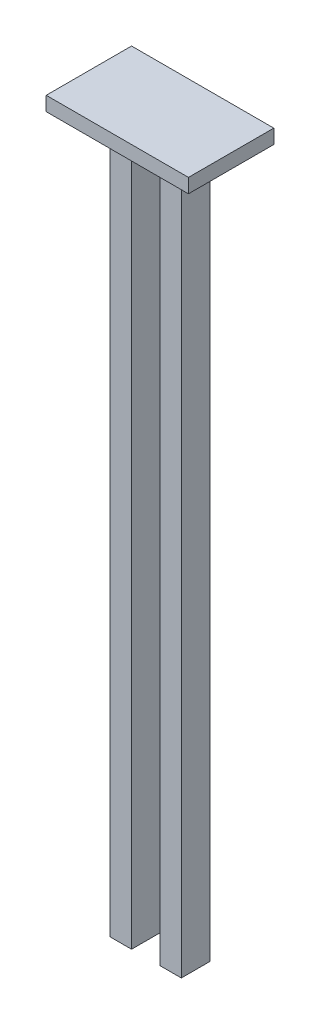
from build123d import *

# Parameters (mm, degrees)
SKETCH1_W           = 10
SKETCH1_H           = 6
BOSS_EXTRUDE1_DEPTH = 1
SKETCH2_W           = 1.5
SKETCH2_H           = 2
BOSS_EXTRUDE2_DEPTH = 50


with BuildPart() as part:
    # Sketch1 → Boss-Extrude1 (new body)
    with BuildSketch(Plane(origin=(0, 0, 0), x_dir=(1, 0, 0), z_dir=(0, 1, 0))):
        Rectangle(SKETCH1_W, SKETCH1_H)
    extrude(amount=BOSS_EXTRUDE1_DEPTH)

    # Sketch2 → Boss-Extrude2 (add)
    with BuildSketch(Plane.XZ):
        with Locations((-1.75, 0)):
            Rectangle(SKETCH2_W, SKETCH2_H)
        with Locations((1.75, 0)):
            Rectangle(SKETCH2_W, SKETCH2_H)
    extrude(amount=BOSS_EXTRUDE2_DEPTH)


solid = part.part
